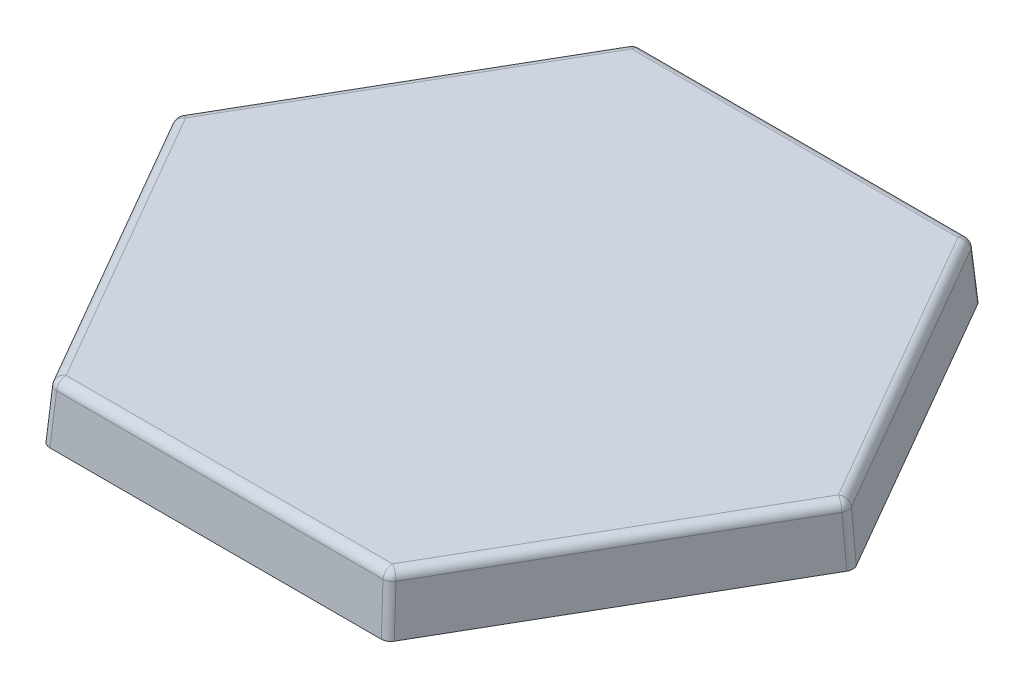
from build123d import *

# Parameters (mm, degrees)
BOSS_EXTRUDE1_DEPTH = 12
BOSS_EXTRUDE1_TAPER = 5
CUT_EXTRUDE1_DEPTH  = 10
CUT_EXTRUDE1_DRAFT  = -5
CUT_EXTRUDE2_DEPTH  = 1
FILLET1_R           = 2


with BuildPart() as part:
    # Sketch1 → Boss-Extrude1 (new body)
    with BuildSketch(Plane(origin=(0, 0, 0), x_dir=(1, 0, 0), z_dir=(0, 1, 0))):
        Polygon((71.807612477, 0), (35.903806238, 62.18721659), (-35.903806238, 62.18721659), (-71.807612477, 0), (-35.903806238, -62.18721659), (35.903806238, -62.18721659), align=None)
    extrude(amount=BOSS_EXTRUDE1_DEPTH, taper=BOSS_EXTRUDE1_TAPER)


with BuildPart() as cut_extrude1_tool:
    # Sketch2 → Cut-Extrude1 (with draft: the straight prism first)
    with BuildSketch(Plane.XZ):
        Polygon((68.704682034, 0), (34.352341017, 59.5), (-34.352341017, 59.5), (-68.704682034, 0), (-34.352341017, -59.5), (34.352341017, -59.5), align=None)
    extrude(amount=-CUT_EXTRUDE1_DEPTH)
    # Cut-Extrude1: the draft: its side faces are tilted about the plane it starts from
    cut_extrude1_sides = [cut_extrude1_tool.faces().sort_by_distance(p)[0] for p in [
        (51.528511525, 5, 29.75),
        (0, 5, 59.5),
        (-51.528511525, 5, 29.75),
        (-51.528511525, 5, -29.75),
        (0, 5, -59.5),
        (51.528511525, 5, -29.75),
    ]]
    draft(cut_extrude1_sides, Plane.XZ, CUT_EXTRUDE1_DRAFT)


with BuildPart() as part_1:
    add(part.part)

    # Cut-Extrude1: cut by cut_extrude1_tool
    add(cut_extrude1_tool.part, mode=Mode.SUBTRACT)

    # Sketch3 → Cut-Extrude2 (cut)
    with BuildSketch(Plane.XZ):
        Polygon((70.436732841, 0), (35.218366421, 61), (-35.218366421, 61), (-70.436732841, 0), (-35.218366421, -61), (35.218366421, -61), align=None)
    extrude(amount=-CUT_EXTRUDE2_DEPTH, mode=Mode.SUBTRACT)

    # Fillet1
    fillet1_edges = [part_1.edges().sort_by_distance(p)[0] for p in [
        (35.600736618, 6, 61.662284609),
        (-35.600736618, 6, 61.662284609),
        (-71.201473236, 6, 0),
        (-35.600736618, 6, -61.662284609),
        (35.600736618, 6, -61.662284609),
        (71.201473236, 6, 0),
        (0, 12, -61.137352628),
        (-52.946500496, 12, -30.568676314),
        (-52.946500496, 12, 30.568676314),
        (0, 12, 61.137352628),
        (52.946500496, 12, 30.568676314),
        (52.946500496, 12, -30.568676314),
    ]]
    fillet(fillet1_edges, radius=FILLET1_R)


solid = part_1.part
